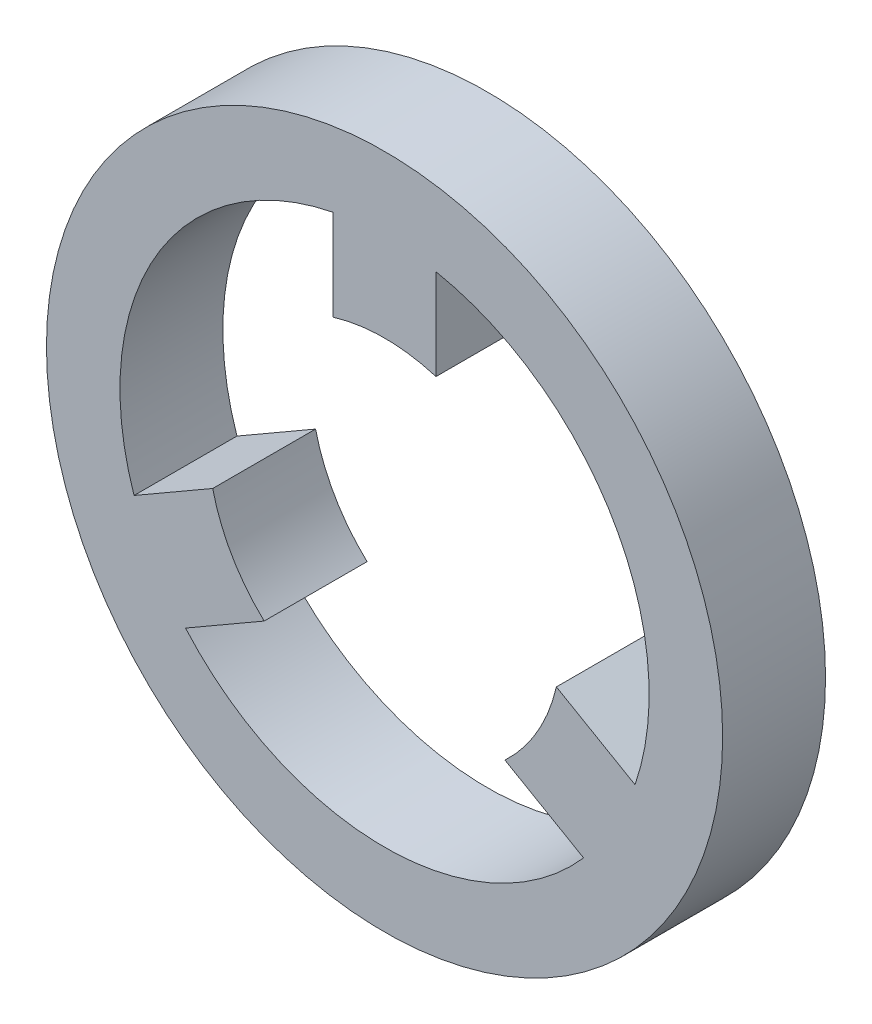
from build123d import *

# Parameters (mm, degrees)
SKETCH1_R           = 11.5
SKETCH1_R_2         = 9
BOSS_EXTRUDE1_DEPTH = 3.5


with BuildPart() as part:
    # Sketch1 → Boss-Extrude1 (new body)
    # profile 1 of 4: a face of its own
    with BuildSketch(Plane.XY):
        Circle(SKETCH1_R)
        Circle(SKETCH1_R_2, mode=Mode.SUBTRACT)
    # profile 2 of 4: a face of its own
    with BuildSketch(Plane.XY):
        with BuildLine():
            Line((1.75, 5.739120142), (1.75, 8.828221792))
            ThreePointArc((1.75, 8.828221792), (0, 9), (-1.75, 8.828221792))
            Line((-1.75, 8.828221792), (-1.75, 5.739120142))
            ThreePointArc((-1.75, 5.739120142), (0, 6), (1.75, 5.739120142))
        make_face()
    # profile 3 of 4: a face of its own
    with BuildSketch(Plane.XY):
        with BuildLine():
            ThreePointArc((-8.520464342, -2.898566439), (-7.794228634, -4.5), (-6.770464342, -5.929655352))
            Line((-6.770464342, -5.929655352), (-4.095223838, -4.385104527))
            ThreePointArc((-4.095223838, -4.385104527), (-5.196152423, -3), (-5.845223838, -1.354015614))
            Line((-5.845223838, -1.354015614), (-8.520464342, -2.898566439))
        make_face()
    # profile 4 of 4: a face of its own
    with BuildSketch(Plane.XY):
        with BuildLine():
            ThreePointArc((6.770464342, -5.929655352), (7.794228634, -4.5), (8.520464342, -2.898566439))
            Line((8.520464342, -2.898566439), (5.845223838, -1.354015614))
            ThreePointArc((5.845223838, -1.354015614), (5.196152423, -3), (4.095223838, -4.385104527))
            Line((4.095223838, -4.385104527), (6.770464342, -5.929655352))
        make_face()
    extrude(amount=BOSS_EXTRUDE1_DEPTH)


solid = part.part
